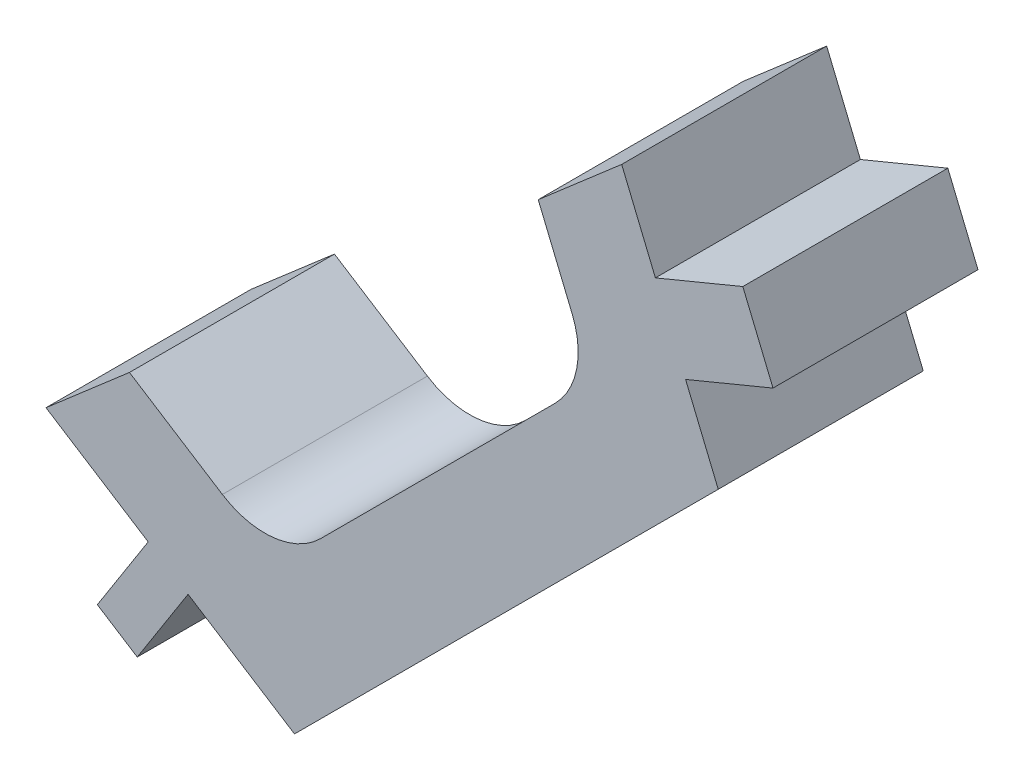
from build123d import *

# Parameters (mm, degrees)
SKETCH1_W      = 203.2
SKETCH1_H      = 101.6
EXTRUDE1_DEPTH = 50.8
EXTRUDE2_DEPTH = 16.51
SKETCH20_W     = 203.2
SKETCH20_H     = 50.8
EXTRUDE3_DEPTH = 1270


with BuildPart() as part:
    # Sketch1 → Extrude1 (new body)
    with BuildSketch(Plane.XY):
        with Locations((101.6, 50.8)):
            Rectangle(SKETCH1_W, SKETCH1_H)
    extrude(amount=EXTRUDE1_DEPTH)

    # Sketch6 → Extrude2 (add)
    with BuildSketch(Plane.XY.offset(50.8)):
        with BuildLine():
            ThreePointArc((37.627484075, 52.10066287), (41.730641244, 51.143940803), (45.529464649, 52.96607049))
            Line((45.529464649, 52.96607049), (64.421207315, 71.857813157))
            ThreePointArc((64.421207315, 71.857813157), (66.159065786, 75.109117673), (65.797714286, 78.777981013))
            Line((65.797714286, 78.777981013), (63.063921217, 85.377941317))
            Line((63.063921217, 85.377941317), (69.784164904, 91.197771623))
            Line((69.784164904, 91.197771623), (72.499996333, 84.641174554))
            Line((72.499996333, 84.641174554), (79.539958371, 87.557222308))
            Line((79.539958371, 87.557222308), (81.969998167, 81.690587277))
            Line((81.969998167, 81.690587277), (74.930036129, 78.774539522))
            Line((74.930036129, 78.774539522), (77.56029225, 72.424539522))
            Line((77.56029225, 72.424539522), (43.43531899, 38.299566262))
            Line((43.43531899, 38.299566262), (34.866461901, 43.758530283))
            Line((34.866461901, 43.758530283), (37.302310042, 45.218374053))
            Line((37.302310042, 45.218374053), (31.946774361, 48.630226566))
            Line((31.946774361, 48.630226566), (31.653140492, 45.805641791))
            Line((31.653140492, 45.805641791), (23.4233337, 51.04860695))
            Line((23.4233337, 51.04860695), (30.143577387, 56.868437256))
            Line((30.143577387, 56.868437256), (37.627484075, 52.10066287))
        make_face()
        Polygon((31.946774361, 48.630226566), (31.653140492, 45.805641791), (27.558917476, 39.378998974), (30.772238885, 37.331887466), (34.866461901, 43.758530283), (37.302310042, 45.218374053), align=None)
    extrude(amount=EXTRUDE2_DEPTH)

    # Sketch20 → Extrude3 (cut)
    with BuildSketch(Plane.XZ):
        with Locations((101.6, 25.4)):
            Rectangle(SKETCH20_W, SKETCH20_H)
    extrude(amount=-EXTRUDE3_DEPTH, mode=Mode.SUBTRACT)


solid = part.part
